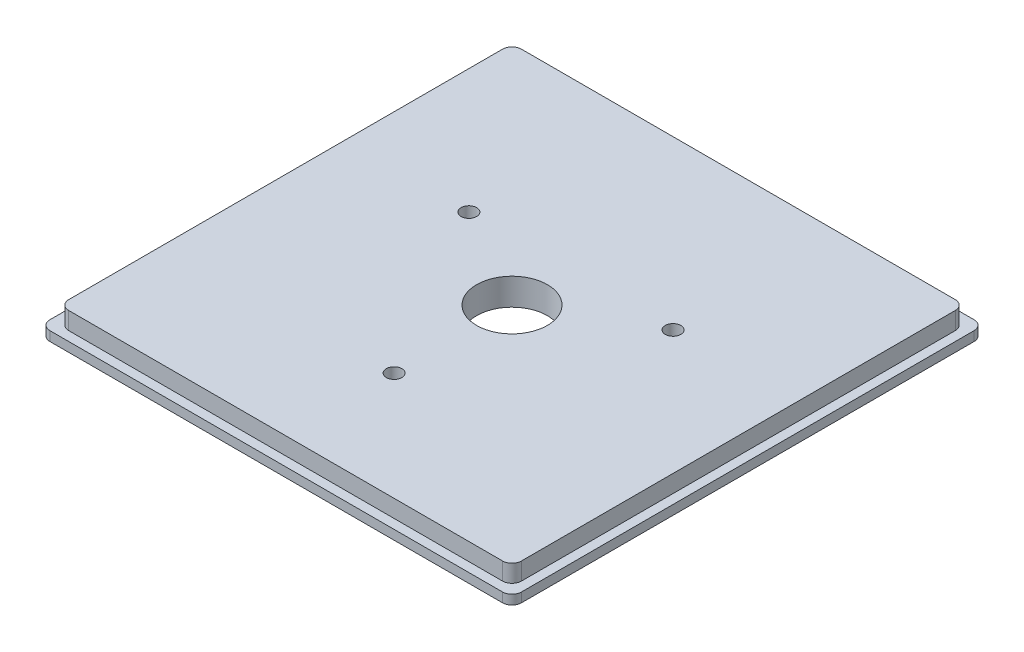
from build123d import *

# Parameters (mm, degrees)
ESBO_O2_W                = 100
ESBO_O2_H                = 100
RESSALTO_EXTRUS_O1_DEPTH = 2
ESBO_O2_3_W              = 96
ESBO_O2_3_H              = 96
RESSALTO_EXTRUS_O2_DEPTH = 5.7
FILETE2_R                = 2
ESBO_O4_R                = 7.5
ESBO_O4_R_2              = 1.65
CORTE_EXTRUS_O1_DEPTH    = 142.53617912


with BuildPart() as part:
    # Esboço2 → Ressalto-extrusão1 (new body)
    with BuildSketch(Plane(origin=(0, 0, 0), x_dir=(1, 0, 0), z_dir=(0, 1, 0))):
        with Locations((50, 50)):
            Rectangle(ESBO_O2_W, ESBO_O2_H)
    extrude(amount=RESSALTO_EXTRUS_O1_DEPTH)

    # Esboço2<3> → Ressalto-extrusão2 (add)
    with BuildSketch(Plane(origin=(0, 0, 0), x_dir=(1, 0, 0), z_dir=(0, 1, 0))):
        with Locations((50, 50)):
            Rectangle(ESBO_O2_3_W, ESBO_O2_3_H)
    extrude(amount=RESSALTO_EXTRUS_O2_DEPTH)

    # Filete2
    filete2_edges = [part.edges().sort_by_distance(p)[0] for p in [
        (0, 1, 0),
        (2, 3.85, -2),
        (100, 1, 0),
        (98, 3.85, -2),
        (100, 1, -100),
        (98, 3.85, -98),
        (0, 1, -100),
        (2, 3.85, -98),
    ]]
    fillet(filete2_edges, radius=FILETE2_R)

    # Esboço4 → Corte-extrusão1 (cut, through all)
    with BuildSketch(Plane(origin=(0, 0, 0), x_dir=(1, 0, 0), z_dir=(0, 1, 0))):
        with Locations((50, 50)):
            Circle(ESBO_O4_R)
        with Locations((50, 25)):
            Circle(ESBO_O4_R_2)
        with Locations((28.349364905, 62.5)):
            Circle(ESBO_O4_R_2)
        with Locations((71.650635095, 62.5)):
            Circle(ESBO_O4_R_2)
    extrude(amount=CORTE_EXTRUS_O1_DEPTH, mode=Mode.SUBTRACT)


solid = part.part
